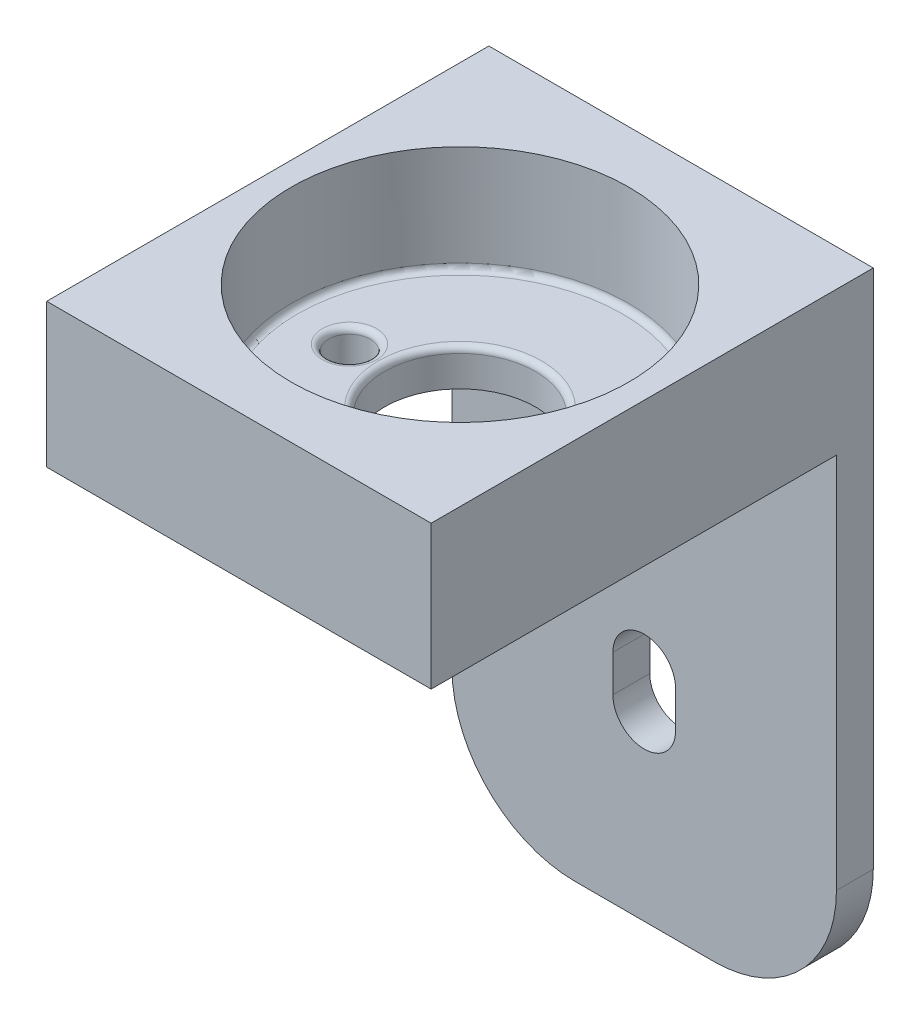
from build123d import *

# Parameters (mm, degrees)
SKETCH1_W                      = 31.3
SKETCH1_H                      = 52.4
BOSS_EXTRUDE1_DEPTH            = 3
SKETCH2_W                      = 31.3
SKETCH2_H                      = 3
BOSS_EXTRUDE2_DEPTH            = 33
SKETCH3_W                      = 31.3
SKETCH3_H                      = 8.7
BOSS_EXTRUDE3_DEPTH            = 33
SKETCH5_R                      = 13.75
CUT_EXTRUDE1_DEPTH             = 8.7
SKETCH6_R                      = 6.15
CUT_EXTRUDE2_DEPTH             = 3
CUT_EXTRUDE3_REACH             = 58.546
SKETCH7_R                      = 1.7
CUT_EXTRUDE3_DIRECTION_2_REACH = 58.546
FILLET4_R                      = 0.5
CUT_EXTRUDE6_DEPTH             = 3
FILLET5_R                      = 10


with BuildPart() as part:
    # Sketch1 → Boss-Extrude1 (new body)
    with BuildSketch(Plane.XY):
        Rectangle(SKETCH1_W, SKETCH1_H)
    extrude(amount=BOSS_EXTRUDE1_DEPTH)

    # Sketch2 → Boss-Extrude2 (add)
    with BuildSketch(Plane.XY.offset(3)):
        with Locations((0, 16)):
            Rectangle(SKETCH2_W, SKETCH2_H)
    extrude(amount=BOSS_EXTRUDE2_DEPTH)

    # Sketch3 → Boss-Extrude3 (add)
    with BuildSketch(Plane.XY.offset(3)):
        with Locations((0, 21.85)):
            Rectangle(SKETCH3_W, SKETCH3_H)
    extrude(amount=BOSS_EXTRUDE3_DEPTH)

    # Sketch5 → Cut-Extrude1 (cut)
    with BuildSketch(Plane(origin=(0, 26.2, 0), x_dir=(1, 0, 0), z_dir=(0, 1, 0))):
        with Locations(Location((0, -18, 0), (0, 0, 270))):
            Circle(SKETCH5_R)
    extrude(amount=-CUT_EXTRUDE1_DEPTH, mode=Mode.SUBTRACT)

    # Sketch6 → Cut-Extrude2 (cut)
    with BuildSketch(Plane(origin=(0, 17.5, 0), x_dir=(1, 0, 0), z_dir=(0, 1, 0))):
        with Locations(Location((0, -18, 0), (0, 0, 180))):
            Circle(SKETCH6_R)
    extrude(amount=-CUT_EXTRUDE2_DEPTH, mode=Mode.SUBTRACT)

    # Cut-Extrude3: up to this face of the body (flat: up to its plane)
    cut_extrude3_end = Plane(part.part.faces().sort_by_distance((0, -26.2, 1.5))[0])
    # Sketch7 → Cut-Extrude3 (cut, up to the picked face)
    with BuildSketch(Plane.XZ.offset(-14.5), mode=Mode.PRIVATE) as cut_extrude3_sk1:
        with Locations(Location((-9, 18, 0), (0, 0, 180))):
            Circle(SKETCH7_R)
    cut_extrude3_tool1 = split(extrude(cut_extrude3_sk1.sketch, amount=CUT_EXTRUDE3_REACH, mode=Mode.PRIVATE), bisect_by=cut_extrude3_end, keep=Keep.BOTH, mode=Mode.PRIVATE)
    # Sketch7 → Cut-Extrude3 (cut, up to the picked face)
    with BuildSketch(Plane.XZ.offset(-14.5), mode=Mode.PRIVATE) as cut_extrude3_sk2:
        with Locations(Location((9, 18, 0), (0, 0, 180))):
            Circle(SKETCH7_R)
    cut_extrude3_tool2 = split(extrude(cut_extrude3_sk2.sketch, amount=CUT_EXTRUDE3_REACH, mode=Mode.PRIVATE), bisect_by=cut_extrude3_end, keep=Keep.BOTH, mode=Mode.PRIVATE)
    add(cut_extrude3_tool1.solids().sort_by(Axis((-9, 14.5, 18), (0, -1, 0)))[0], mode=Mode.SUBTRACT)
    add(cut_extrude3_tool2.solids().sort_by(Axis((9, 14.5, 18), (0, -1, 0)))[0], mode=Mode.SUBTRACT)

    # Cut-Extrude3 direction 2: up to this face of the body (flat: up to its plane)
    cut_extrude3_direction_2_end = Plane(part.part.faces().sort_by_distance((0, 17.5, 4.63890873))[0])
    # Sketch7 → Cut-Extrude3 direction 2 (cut, up to the picked face)
    with BuildSketch(Plane.XZ.offset(-14.5), mode=Mode.PRIVATE) as cut_extrude3_direction_2_sk1:
        with Locations(Location((-9, 18, 0), (0, 0, 180))):
            Circle(SKETCH7_R)
    cut_extrude3_direction_2_tool1 = split(extrude(cut_extrude3_direction_2_sk1.sketch, amount=-CUT_EXTRUDE3_DIRECTION_2_REACH, mode=Mode.PRIVATE), bisect_by=cut_extrude3_direction_2_end, keep=Keep.BOTH, mode=Mode.PRIVATE)
    # Sketch7 → Cut-Extrude3 direction 2 (cut, up to the picked face)
    with BuildSketch(Plane.XZ.offset(-14.5), mode=Mode.PRIVATE) as cut_extrude3_direction_2_sk2:
        with Locations(Location((9, 18, 0), (0, 0, 180))):
            Circle(SKETCH7_R)
    cut_extrude3_direction_2_tool2 = split(extrude(cut_extrude3_direction_2_sk2.sketch, amount=-CUT_EXTRUDE3_DIRECTION_2_REACH, mode=Mode.PRIVATE), bisect_by=cut_extrude3_direction_2_end, keep=Keep.BOTH, mode=Mode.PRIVATE)
    add(cut_extrude3_direction_2_tool1.solids().sort_by(Axis((-9, 14.5, 18), (0, 1, 0)))[0], mode=Mode.SUBTRACT)
    add(cut_extrude3_direction_2_tool2.solids().sort_by(Axis((9, 14.5, 18), (0, 1, 0)))[0], mode=Mode.SUBTRACT)

    # Fillet4
    fillet4_edges = [part.edges().sort_by_distance(p)[0] for p in [
        (0, 17.5, 4.25),
        (6.15, 17.5, 18),
        (-7.3, 17.5, 18),
        (10.7, 17.5, 18),
    ]]
    fillet(fillet4_edges, radius=FILLET4_R)

    # Sketch10 → Cut-Extrude6 (cut)
    with BuildSketch(Plane(origin=(0, 0, 0), x_dir=(-1, 0, 0), z_dir=(0, 0, -1))):
        with BuildLine():
            Line((-2.55, -11.5), (-2.55, -8.5))
            ThreePointArc((-2.55, -8.5), (0, -5.95), (2.55, -8.5))
            Line((2.55, -8.5), (2.55, -11.5))
            ThreePointArc((2.55, -11.5), (0, -14.05), (-2.55, -11.5))
        make_face()
        with BuildLine():
            Line((-2.55, 8.5), (-2.55, 11.5))
            ThreePointArc((-2.55, 11.5), (0, 14.05), (2.55, 11.5))
            Line((2.55, 11.5), (2.55, 8.5))
            ThreePointArc((2.55, 8.5), (0, 5.95), (-2.55, 8.5))
        make_face()
    extrude(amount=-CUT_EXTRUDE6_DEPTH, mode=Mode.SUBTRACT)

    # Fillet5
    fillet5_edges = [part.edges().sort_by_distance(p)[0] for p in [
        (15.65, -26.2, 1.5),
        (-15.65, -26.2, 1.5),
    ]]
    fillet(fillet5_edges, radius=FILLET5_R)


solid = part.part
